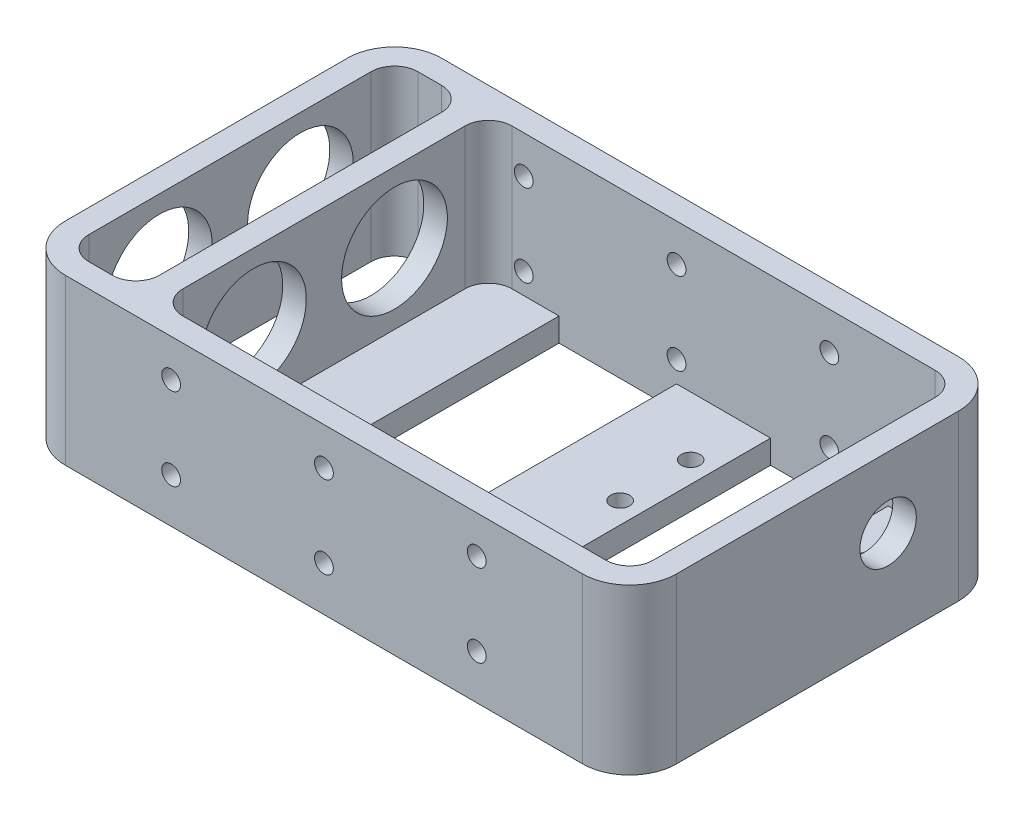
from build123d import *

# Parameters (mm, degrees)
SKETCH1_W           = 165.1
SKETCH1_H           = 101.6
SKETCH1_R           = 2.54
SKETCH1_W_2         = 133.35
SKETCH1_H_2         = 88.9
SKETCH1_W_3         = 25.4
MOUNTING_BASE_DEPTH = 6.35
SKETCH2_W           = 165.1
SKETCH2_H           = 101.6
SKETCH2_W_2         = 6.35
SKETCH2_H_2         = 88.9
WALLS_DEPTH         = 38.1
SKETCH3_R           = 14.2875
BEARING_HOLES_DEPTH = 38.1
SKETCH4_R           = 7.62
SHAFT_HOLES_DEPTH   = 38.1
SKETCH5_R           = 2.54
MOD_HOLES_DEPTH     = 139.249285712
OUTSIDE_VERTICES_R  = 12.7
INSIDE_VERTICES_R   = 6.35


with BuildPart() as part:
    # Sketch1 → Mounting Base (new body)
    # profile 1 of 3: a face of its own
    with BuildSketch(Plane(origin=(0, 0, 0), x_dir=(1, 0, 0), z_dir=(0, 1, 0))):
        Rectangle(SKETCH1_W, SKETCH1_H)
        with Locations(Location((66.675, 9.525, 0), (0, 0, 270))):
            Circle(SKETCH1_R, mode=Mode.SUBTRACT)
        with Locations(Location((66.675, 28.575, 0), (0, 0, 270))):
            Circle(SKETCH1_R, mode=Mode.SUBTRACT)
        with Locations((-9.525, 0)):
            Rectangle(SKETCH1_W_2, SKETCH1_H_2, mode=Mode.SUBTRACT)
    # profile 2 of 3: a face of its own
    with BuildSketch(Plane(origin=(0, 0, 0), x_dir=(1, 0, 0), z_dir=(0, 1, 0))):
        with Locations((-44.45, 0)):
            Rectangle(SKETCH1_W_3, SKETCH1_H_2)
        with Locations(Location((-41.275, -28.575, 0), (0, 0, 270))):
            Circle(SKETCH1_R, mode=Mode.SUBTRACT)
        with Locations(Location((-41.275, -9.525, 0), (0, 0, 270))):
            Circle(SKETCH1_R, mode=Mode.SUBTRACT)
    # profile 3 of 3: a face of its own
    with BuildSketch(Plane(origin=(0, 0, 0), x_dir=(1, 0, 0), z_dir=(0, 1, 0))):
        with Locations((12.7, 0)):
            Rectangle(SKETCH1_W_3, SKETCH1_H_2)
        with Locations(Location((5.715, -28.575, 0), (0, 0, 270))):
            Circle(SKETCH1_R, mode=Mode.SUBTRACT)
        with Locations(Location((5.715, -9.525, 0), (0, 0, 270))):
            Circle(SKETCH1_R, mode=Mode.SUBTRACT)
        with Locations(Location((19.685, 9.525, 0), (0, 0, 270))):
            Circle(SKETCH1_R, mode=Mode.SUBTRACT)
        with Locations(Location((19.685, 28.575, 0), (0, 0, 270))):
            Circle(SKETCH1_R, mode=Mode.SUBTRACT)
    extrude(amount=MOUNTING_BASE_DEPTH)

    # Sketch2 → Walls (add)
    # profile 1 of 2: a face of its own
    with BuildSketch(Plane(origin=(0, 6.35, 0), x_dir=(1, 0, 0), z_dir=(0, 1, 0))):
        Rectangle(SKETCH2_W, SKETCH2_H)
        Polygon((-57.15, -44.45), (-76.2, -44.45), (-76.2, 44.45), (-57.15, 44.45), (-50.8, 44.45), (-31.75, 44.45), (0, 44.45), (25.4, 44.45), (57.15, 44.45), (76.2, 44.45), (76.2, -44.45), (57.15, -44.45), (25.4, -44.45), (0, -44.45), (-31.75, -44.45), (-50.8, -44.45), align=None, mode=Mode.SUBTRACT)
    # profile 2 of 2: a face of its own
    with BuildSketch(Plane(origin=(0, 6.35, 0), x_dir=(1, 0, 0), z_dir=(0, 1, 0))):
        with Locations((-53.975, 0)):
            Rectangle(SKETCH2_W_2, SKETCH2_H_2)
    extrude(amount=WALLS_DEPTH)

    # Sketch3 → Bearing Holes (cut)
    with BuildSketch(Plane.ZY.offset(82.55)):
        with Locations((-19.05, 25.4)):
            Circle(SKETCH3_R)
        with Locations((19.05, 25.4)):
            Circle(SKETCH3_R)
    extrude(amount=-BEARING_HOLES_DEPTH, mode=Mode.SUBTRACT)

    # Sketch4 → Shaft Holes (cut)
    with BuildSketch(Plane(origin=(82.55, 0, 0), x_dir=(0, 0, -1), z_dir=(1, 0, 0))):
        with Locations((19.05, 25.4)):
            Circle(SKETCH4_R)
    extrude(amount=-SHAFT_HOLES_DEPTH, mode=Mode.SUBTRACT)

    # Sketch5 → Mod Holes (cut, through all)
    with BuildSketch(Plane(origin=(0, 0, -50.8), x_dir=(-1, 0, 0), z_dir=(0, 0, -1))):
        with Locations((-41.275, 34.29)):
            Circle(SKETCH5_R)
        with Locations((-41.275, 12.065)):
            Circle(SKETCH5_R)
        with Locations((41.275, 34.29)):
            Circle(SKETCH5_R)
        with Locations((41.275, 12.065)):
            Circle(SKETCH5_R)
        with Locations((0, 34.29)):
            Circle(SKETCH5_R)
        with Locations((0, 12.065)):
            Circle(SKETCH5_R)
    extrude(amount=-MOD_HOLES_DEPTH, mode=Mode.SUBTRACT)

    # Outside Vertices
    outside_vertices_edges = [part.edges().sort_by_distance(p)[0] for p in [
        (-82.55, 22.225, 50.8),
        (-82.55, 22.225, -50.8),
        (82.55, 22.225, -50.8),
        (82.55, 22.225, 50.8),
    ]]
    fillet(outside_vertices_edges, radius=OUTSIDE_VERTICES_R)

    # Inside Vertices
    inside_vertices_edges = [part.edges().sort_by_distance(p)[0] for p in [
        (-76.2, 22.225, 44.45),
        (-76.2, 22.225, -44.45),
        (76.2, 25.4, 44.45),
        (76.2, 25.4, -44.45),
        (-50.8, 25.4, -44.45),
        (-50.8, 25.4, 44.45),
        (-57.15, 22.225, 44.45),
        (-57.15, 22.225, -44.45),
    ]]
    fillet(inside_vertices_edges, radius=INSIDE_VERTICES_R)


solid = part.part
